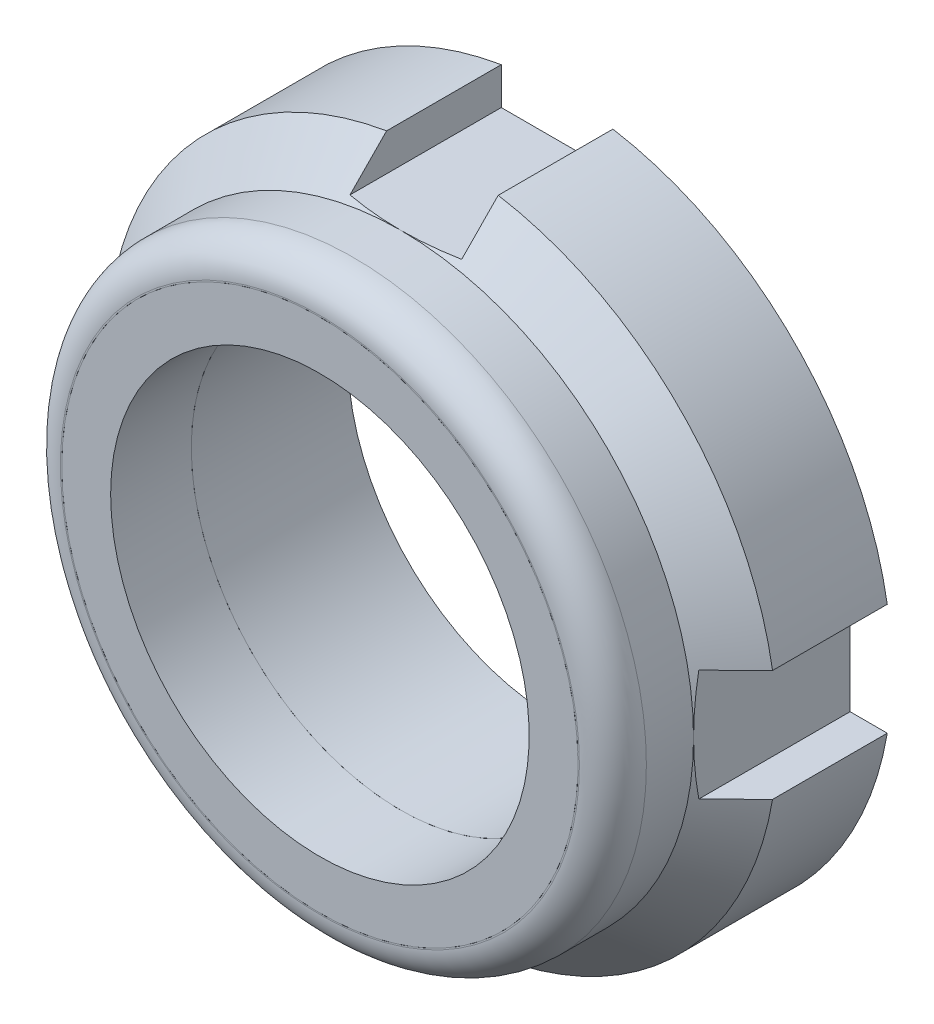
from build123d import *

# Parameters (mm, degrees)
BOSS_EXTRUDE1_DEPTH      = 4.25
BOSS_EXTRUDE1_DEPTH_BACK = 4.25
SKETCH4_R                = 12
SKETCH4_R_2              = 7.5
SKETCH5_R                = 12
SKETCH5_R_2              = 11
CUT_EXTRUDE1_DEPTH       = 0.5
SKETCH16_W               = 4
SKETCH16_H               = 1.5
CUT_EXTRUDE7_DEPTH       = 18.494642037
CIRPATTERN1_COUNT        = 4
FILLET1_R                = 1.2
SKETCH19_R               = 9.25
CUT_EXTRUDE8_DEPTH       = 2.89
SKETCH20_R               = 9.25
SKETCH20_R_2             = 7.5
BOSS_EXTRUDE2_DEPTH      = 2.89


with BuildPart() as part:
    # Sketch4 → Boss-Extrude1 (new, two sides: drawn at the far end of the back side and taken through both)
    with BuildSketch(Plane.XY.offset(-BOSS_EXTRUDE1_DEPTH_BACK)):
        Circle(SKETCH4_R)
        Circle(SKETCH4_R_2, mode=Mode.SUBTRACT)
    extrude(amount=BOSS_EXTRUDE1_DEPTH + BOSS_EXTRUDE1_DEPTH_BACK)

    # Sketch5 → Cut-Extrude1 (cut)
    with BuildSketch(Plane.XY.offset(4.25)):
        Circle(SKETCH5_R)
        Circle(SKETCH5_R_2, mode=Mode.SUBTRACT)
    extrude(amount=-CUT_EXTRUDE1_DEPTH, mode=Mode.SUBTRACT)

    # Sketch16 → Cut-Extrude7 (cut, symmetric)
    with BuildSketch(Plane.XY):
        with Locations((0, -11.25)):
            Rectangle(SKETCH16_W, SKETCH16_H)
    cut_extrude7 = extrude(amount=CUT_EXTRUDE7_DEPTH, both=True, mode=Mode.SUBTRACT)

    # CirPattern1: Cut-Extrude7 ×4 about axis
    cirpattern1_axis = Axis((0, 0, 0), (0, 0, 1))
    for i in range(1, CIRPATTERN1_COUNT):
        add(cut_extrude7.rotate(cirpattern1_axis, i * 360 / CIRPATTERN1_COUNT), mode=Mode.SUBTRACT)

    # Sketch18 → Cut-Revolve1 (revolve, cut)
    with BuildSketch(Plane(origin=(0, 0, 0), x_dir=(0, 0, -1), z_dir=(1, 0, 0)), mode=Mode.PRIVATE) as cut_revolve1_sk:
        Polygon((-1.36, 10.5), (0.14, 12), (-4.25, 12), (-4.25, 10.5), align=None)
    revolve(cut_revolve1_sk.sketch.rotate(Axis((0, 0, 4.25), (0, 0, -1)), 180), axis=Axis((0, 0, 4.25), (0, 0, -1)), mode=Mode.SUBTRACT)

    # Fillet1
    fillet1_edges = [part.edges().sort_by_distance(p)[0] for p in [
        (0, 10.5, 4.25),
    ]]
    fillet(fillet1_edges, radius=FILLET1_R)

    # Sketch19 → Cut-Extrude8 (cut)
    with BuildSketch(Plane.XY.offset(4.25)):
        Circle(SKETCH19_R)
    extrude(amount=-CUT_EXTRUDE8_DEPTH, mode=Mode.SUBTRACT)


with BuildPart() as body_2:
    # Sketch20 → Boss-Extrude2 (new body)
    with BuildSketch(Plane.XY.offset(1.36)):
        with Locations(Location((0, 0, 0), (0, 0, 180))):
            Circle(SKETCH20_R)
        with Locations(Location((0, 0, 0), (0, 0, 180))):
            Circle(SKETCH20_R_2, mode=Mode.SUBTRACT)
    extrude(amount=BOSS_EXTRUDE2_DEPTH)


solid = Compound([part.part, body_2.part])
